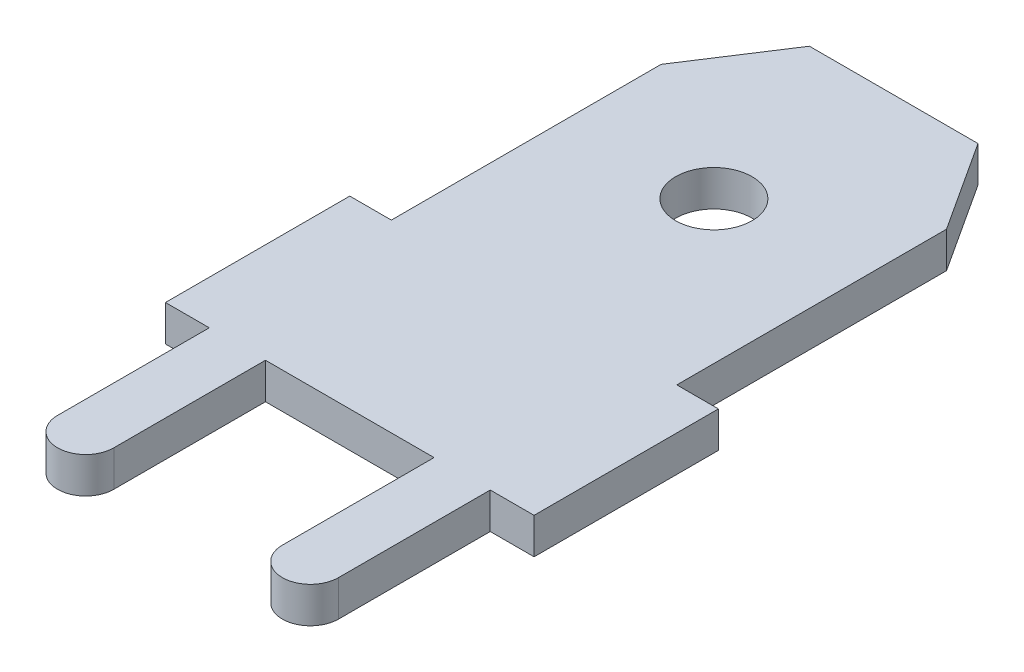
from build123d import *

# Parameters (mm, degrees)
SKETCH1_R           = 0.85
BOSS_EXTRUDE1_DEPTH = 0.4


with BuildPart() as part:
    # Sketch1 → Boss-Extrude1 (new, symmetric)
    with BuildSketch(Plane(origin=(0, 0, 0), x_dir=(1, 0, 0), z_dir=(0, 1, 0))):
        with BuildLine():
            Line((-3.175, 6), (-3.175, 0))
            Line((-3.175, 0), (-4.1, 0))
            Line((-4.1, 0), (-4.1, -4.1))
            Line((-4.1, -4.1), (-3.125, -4.1))
            Line((-3.125, -4.1), (-3.125, -7.475))
            ThreePointArc((-3.125, -7.475), (-2.5, -8.1), (-1.875, -7.475))
            Line((-1.875, -7.475), (-1.875, -4.1))
            Line((-1.875, -4.1), (1.875, -4.1))
            Line((1.875, -4.1), (1.875, -7.475))
            ThreePointArc((1.875, -7.475), (2.5, -8.1), (3.125, -7.475))
            Line((3.125, -7.475), (3.125, -4.1))
            Line((3.125, -4.1), (4.1, -4.1))
            Line((4.1, -4.1), (4.1, 0))
            Line((4.1, 0), (3.175, 0))
            Line((3.175, 0), (3.175, 6))
            Line((3.175, 6), (1.875, 8))
            Line((1.875, 8), (-1.875, 8))
            Line((-1.875, 8), (-3.175, 6))
        make_face()
        with Locations(Location((0, 4, 0), (0, 0, 270))):
            Circle(SKETCH1_R, mode=Mode.SUBTRACT)
    extrude(amount=BOSS_EXTRUDE1_DEPTH, both=True)


solid = part.part
